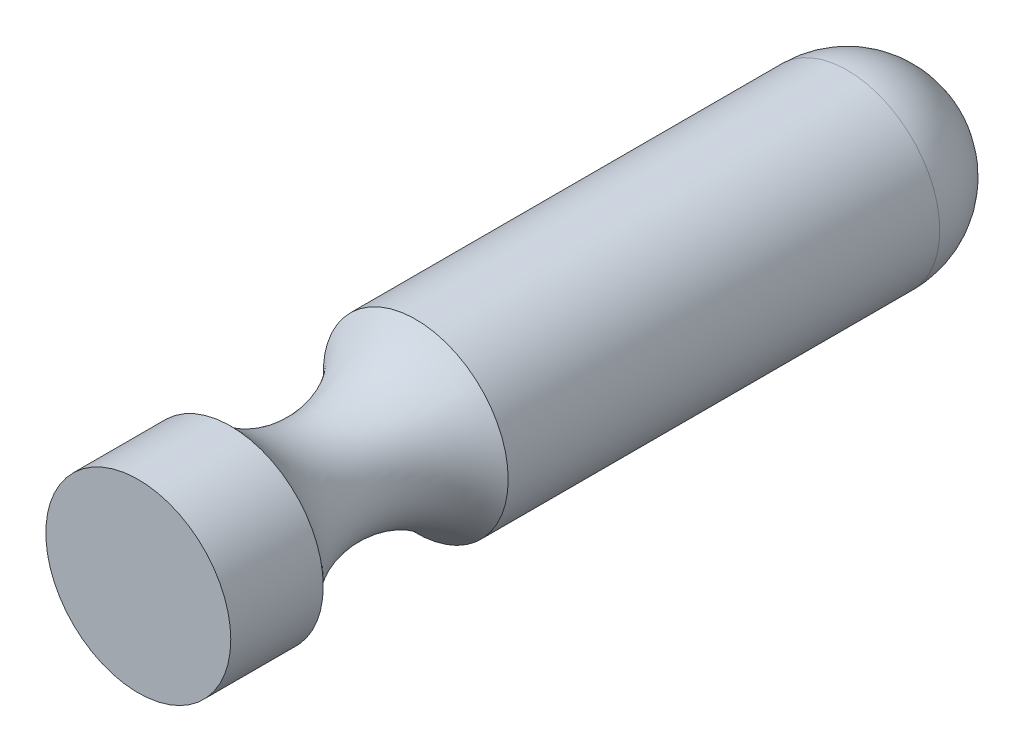
from build123d import *


with BuildPart() as part:
    # Sketch1 → Revolve1 (revolve)
    with BuildSketch(Plane(origin=(0, 0, 0), x_dir=(1, 0, 0), z_dir=(0, 1, 0))):
        with BuildLine():
            Line((2.658139535, -68.225581395), (2.658139535, 96.874418605))
            ThreePointArc((2.658139535, 96.874418605), (16.128523716, 91.294802786), (21.708139535, 77.824418605))
            Line((21.708139535, 77.824418605), (21.708139535, -11.075581395))
            ThreePointArc((21.708139535, -11.075581395), (13.10866036, -30.125581395), (21.708139535, -49.175581395))
            Line((21.708139535, -49.175581395), (21.708139535, -68.225581395))
            Line((21.708139535, -68.225581395), (2.658139535, -68.225581395))
        make_face()
    revolve(axis=Axis((2.658139535, 0, 68.225581395), (0, 0, -1)))


solid = part.part
